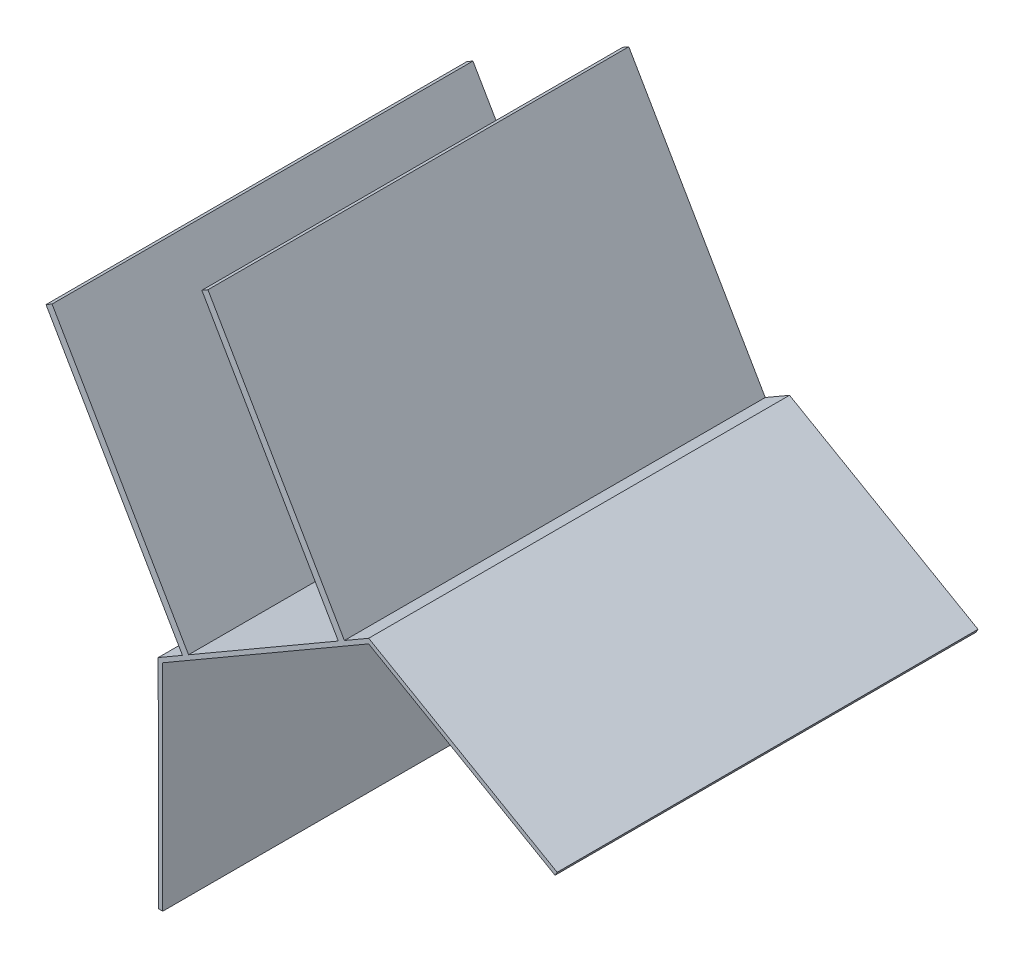
from build123d import *

# Parameters (mm, degrees)
BOSS_EXTRUDE3_DEPTH = 150
SKETCH3_W           = 5
SKETCH3_H           = 300
BOSS_EXTRUDE4_DEPTH = 194.04


with BuildPart() as part:
    # Sketch1 → Boss-Extrude3 (new, symmetric)
    with BuildSketch(Plane.XY):
        Polygon((-605.658970563, 869.326926327), (-605.421491465, 714.331361266), (-602.421487943, 714.331361266), (-602.651320044, 864.335957761), (-602.656320364, 867.599518288), (-455.616774381, 952.797835671), (-452.784185512, 951.168221277), (-322.765615027, 876.367343414), (-321.26959747, 878.967714824), (-451.288167955, 953.768592687), (-455.622120304, 956.261955282), align=None)
    extrude(amount=BOSS_EXTRUDE3_DEPTH, both=True)

    # Sketch3 → Boss-Extrude4 (add)
    with BuildSketch(Plane(origin=(-529.334093448, 913.551431111, 0), x_dir=(0.8652472150761933, 0.5013454465764019, 0), z_dir=(-0.5013454465764018, 0.8652472150761932, 0))):
        with Locations((62.691806295, 0)):
            Rectangle(SKETCH3_W, SKETCH3_H)
        with Locations((-65.711641465, 0)):
            Rectangle(SKETCH3_W, SKETCH3_H)
    extrude(amount=BOSS_EXTRUDE4_DEPTH)


solid = part.part
